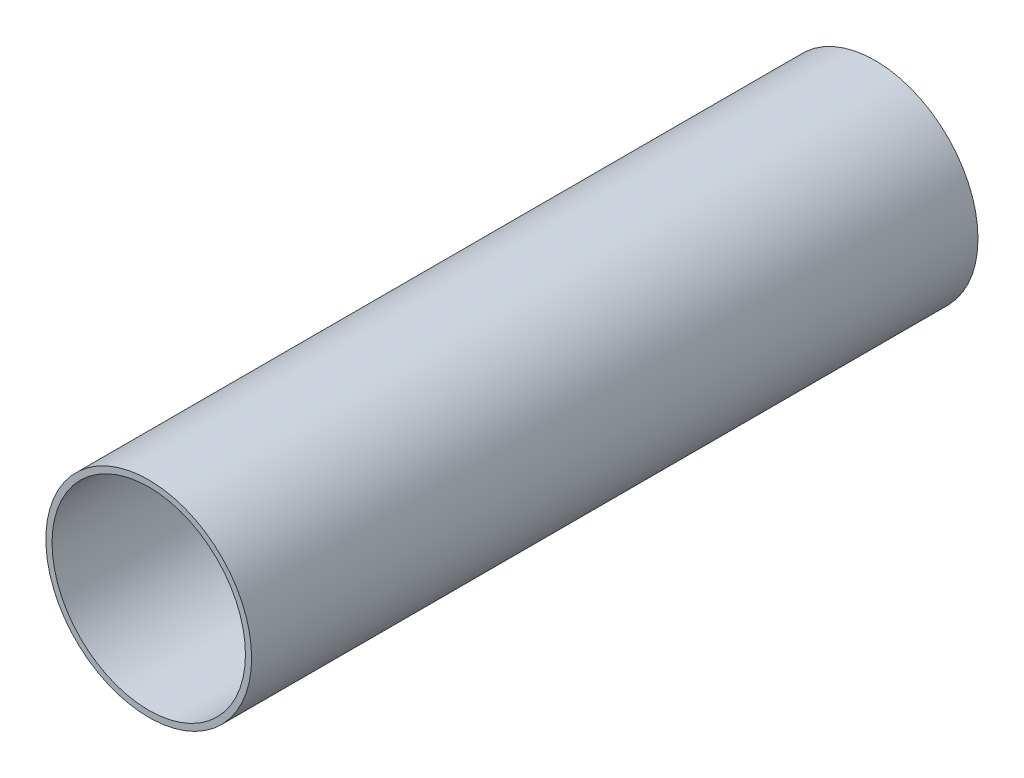
from build123d import *

# Parameters (mm, degrees)
SKETCH_1_R          = 50
EXTRUDE_1_DEPTH     = 3
SKETCH_2_R          = 50
SKETCH_2_R_2        = 47
EXTRUDE_2_DEPTH     = 350
SKETCH_3_R          = 3
CUT_EXTRUDE_1_DEPTH = 350


with BuildPart() as part:
    # Эскиз1 → Бобышка-Вытянуть1 (new body)
    with BuildSketch(Plane.XY):
        Circle(SKETCH_1_R)
    extrude(amount=EXTRUDE_1_DEPTH)

    # Эскиз2 → Бобышка-Вытянуть2 (add)
    with BuildSketch(Plane.XY.offset(3)):
        Circle(SKETCH_2_R)
        Circle(SKETCH_2_R_2, mode=Mode.SUBTRACT)
    extrude(amount=EXTRUDE_2_DEPTH)

    # Эскиз3 → Вырез-Вытянуть1 (cut)
    with BuildSketch(Plane(origin=(0, 0, 0), x_dir=(-1, 0, 0), z_dir=(0, 0, -1))):
        Circle(SKETCH_3_R)
    extrude(amount=-CUT_EXTRUDE_1_DEPTH, mode=Mode.SUBTRACT)


solid = part.part
